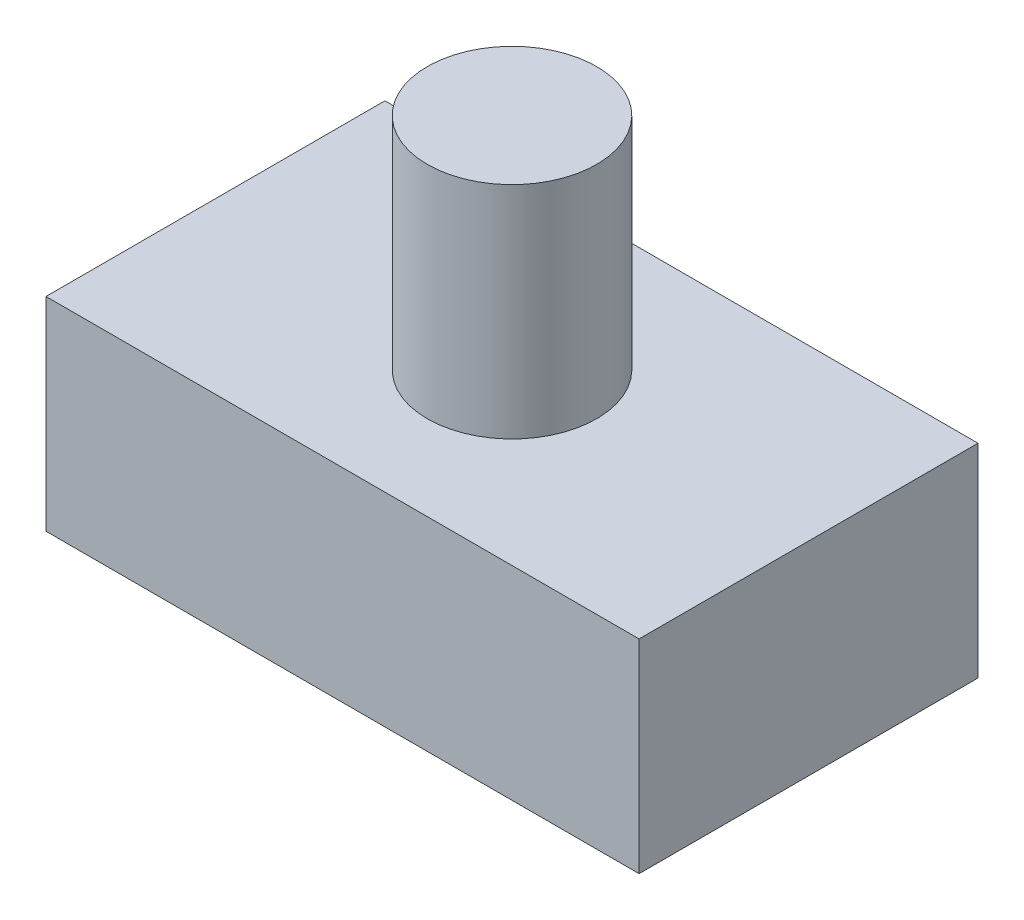
from build123d import *

# Parameters (mm, degrees)
SKETCH1_W           = 35
SKETCH1_H           = 20
SKETCH1_R           = 5
BOSS_EXTRUDE1_DEPTH = 12
SKETCH1_3_R         = 5
BOSS_EXTRUDE2_DEPTH = 25


with BuildPart() as part:
    # Sketch1 → Boss-Extrude1 (new body)
    # profile 1 of 2: a face of its own
    with BuildSketch(Plane(origin=(0, 0, 0), x_dir=(1, 0, 0), z_dir=(0, 1, 0))):
        Rectangle(SKETCH1_W, SKETCH1_H)
        Circle(SKETCH1_R, mode=Mode.SUBTRACT)
    # profile 2 of 2: a face of its own
    with BuildSketch(Plane(origin=(0, 0, 0), x_dir=(1, 0, 0), z_dir=(0, 1, 0))):
        Circle(SKETCH1_R)
    extrude(amount=BOSS_EXTRUDE1_DEPTH)

    # Sketch1<3> → Boss-Extrude2 (add)
    with BuildSketch(Plane(origin=(0, 0, 0), x_dir=(1, 0, 0), z_dir=(0, 1, 0))):
        with Locations(Location((0, 0, 0), (0, 0, 270))):
            Circle(SKETCH1_3_R)
    extrude(amount=BOSS_EXTRUDE2_DEPTH)


solid = part.part
